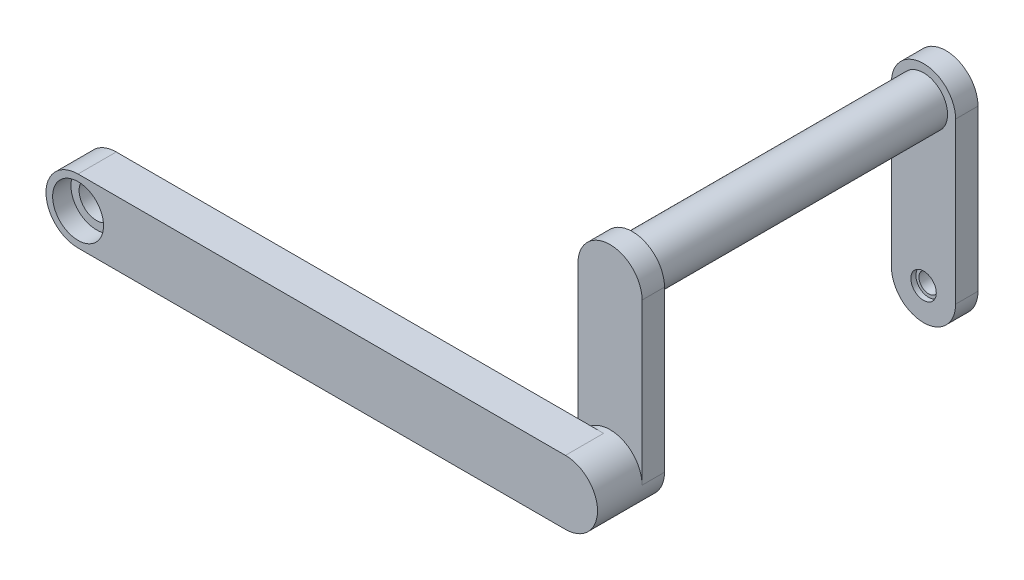
from build123d import *

# Parameters (mm, degrees)
CROQUIS1_R              = 1.7
SALIENTE_EXTRUIR1_DEPTH = 3.75
SALIENTE_EXTRUIR2_START = 0.63
CROQUIS2_R              = 3.15
SALIENTE_EXTRUIR2_DEPTH = 0.63
CROQUIS4_R              = 2.5
CORTAR_EXTRUIR1_DEPTH   = 1.8
SALIENTE_EXTRUIR3_START = 2.2
SALIENTE_EXTRUIR3_DEPTH = 2.2
CROQUIS6_R              = 2.3625
SALIENTE_EXTRUIR4_DEPTH = 28.6
SALIENTE_EXTRUIR5_START = 2.2
CROQUIS7_R              = 0.95
SALIENTE_EXTRUIR5_DEPTH = 2.2
CROQUIS8_R              = 1.25
CORTAR_EXTRUIR2_DEPTH   = 0.5


with BuildPart() as part:
    # Croquis1 → Saliente-Extruir1 (new body)
    with BuildSketch(Plane.XY):
        with BuildLine():
            Line((0, 3.15), (47.88, 3.15))
            ThreePointArc((47.88, 3.15), (51.03, 0), (47.88, -3.15))
            Line((47.88, -3.15), (0, -3.15))
            ThreePointArc((0, -3.15), (-3.15, 0), (0, 3.15))
        make_face()
        Circle(CROQUIS1_R, mode=Mode.SUBTRACT)
    extrude(amount=SALIENTE_EXTRUIR1_DEPTH)

    # Croquis2 → Saliente-Extruir2 (add)
    with BuildSketch(Plane(origin=(0, 0, 0), x_dir=(-1, 0, 0), z_dir=(0, 0, -1)).offset(SALIENTE_EXTRUIR2_START)):
        with Locations((-47.88, 0)):
            Circle(CROQUIS2_R)
    extrude(amount=-SALIENTE_EXTRUIR2_DEPTH)

    # Croquis4 → Cortar-Extruir1 (cut)
    with BuildSketch(Plane.XY.offset(3.75)):
        Circle(CROQUIS4_R)
    extrude(amount=-CORTAR_EXTRUIR1_DEPTH, mode=Mode.SUBTRACT)

    # Croquis5 → Saliente-Extruir3 (add)
    with BuildSketch(Plane(origin=(0, 0, -0.63), x_dir=(-1, 0, 0), z_dir=(0, 0, -1)).offset(SALIENTE_EXTRUIR3_START)):
        with BuildLine():
            Line((-51.03, 15.75), (-51.03, 0))
            ThreePointArc((-51.03, 0), (-47.88, -3.15), (-44.73, 0))
            Line((-44.73, 0), (-44.73, 15.75))
            ThreePointArc((-44.73, 15.75), (-47.88, 18.9), (-51.03, 15.75))
        make_face()
    extrude(amount=-SALIENTE_EXTRUIR3_DEPTH)

    # Croquis6 → Saliente-Extruir4 (add)
    with BuildSketch(Plane(origin=(0, 0, -2.83), x_dir=(-1, 0, 0), z_dir=(0, 0, -1))):
        with Locations((-47.88, 15.75)):
            Circle(CROQUIS6_R)
    extrude(amount=SALIENTE_EXTRUIR4_DEPTH)

    # Croquis7 → Saliente-Extruir5 (add)
    with BuildSketch(Plane(origin=(0, 0, -31.43), x_dir=(-1, 0, 0), z_dir=(0, 0, -1)).offset(SALIENTE_EXTRUIR5_START)):
        with BuildLine():
            Line((-51.03, 15.75), (-51.03, 0))
            ThreePointArc((-51.03, 0), (-47.88, -3.15), (-44.73, 0))
            Line((-44.73, 0), (-44.73, 15.75))
            ThreePointArc((-44.73, 15.75), (-47.88, 18.9), (-51.03, 15.75))
        make_face()
        with Locations((-47.88, 0)):
            Circle(CROQUIS7_R, mode=Mode.SUBTRACT)
    extrude(amount=-SALIENTE_EXTRUIR5_DEPTH)

    # Croquis8 → Cortar-Extruir2 (cut)
    with BuildSketch(Plane.XY.offset(-31.43)):
        with Locations((47.88, 0)):
            Circle(CROQUIS8_R)
    extrude(amount=-CORTAR_EXTRUIR2_DEPTH, mode=Mode.SUBTRACT)


solid = part.part
